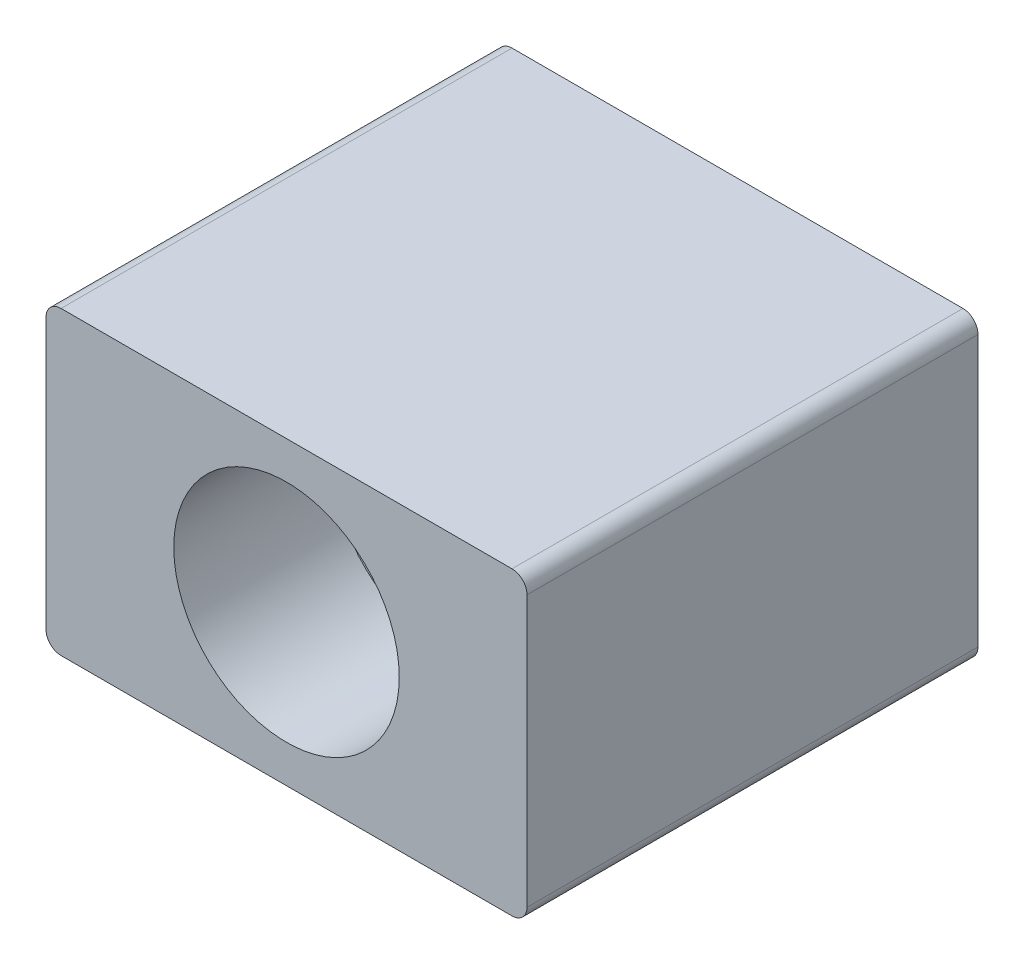
from build123d import *

# Parameters (mm, degrees)
SKETCH1_R           = 5.25
BOSS_EXTRUDE1_DEPTH = 15
SKETCH2_R           = 7.5
CUT_EXTRUDE1_DEPTH  = 10.5


with BuildPart() as part:
    # Sketch1 → Boss-Extrude1 (new, symmetric)
    with BuildSketch(Plane.XY):
        with BuildLine():
            Line((-15, 10), (15, 10))
            ThreePointArc((15, 10), (15.707106781, 9.707106781), (16, 9))
            Line((16, 9), (16, -9))
            ThreePointArc((16, -9), (15.707106781, -9.707106781), (15, -10))
            Line((15, -10), (-15, -10))
            ThreePointArc((-15, -10), (-15.707106781, -9.707106781), (-16, -9))
            Line((-16, -9), (-16, 9))
            ThreePointArc((-16, 9), (-15.707106781, 9.707106781), (-15, 10))
        make_face()
        Circle(SKETCH1_R, mode=Mode.SUBTRACT)
    extrude(amount=BOSS_EXTRUDE1_DEPTH, both=True)

    # Sketch2 → Cut-Extrude1 (cut)
    with BuildSketch(Plane.XY.offset(15)):
        Circle(SKETCH2_R)
    cut_extrude1 = extrude(amount=-CUT_EXTRUDE1_DEPTH, mode=Mode.SUBTRACT)

    # Mirror1: Cut-Extrude1 across plane
    add(cut_extrude1.mirror(Plane.XY), mode=Mode.SUBTRACT)


solid = part.part
